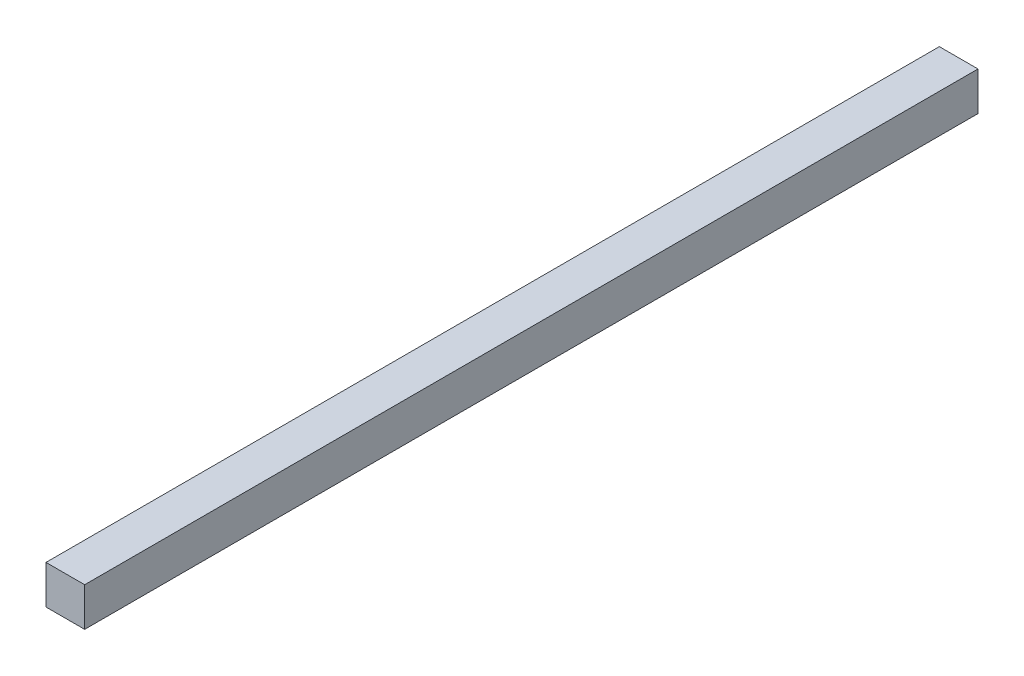
from build123d import *

# Parameters (mm, degrees)
ESQUISSE1_W        = 10
ESQUISSE1_H        = 10
BOSS_EXTRU_1_DEPTH = 231


with BuildPart() as part:
    # Esquisse1 → Boss.-Extru.1 (new body)
    with BuildSketch(Plane.XY):
        with Locations((5, 5)):
            Rectangle(ESQUISSE1_W, ESQUISSE1_H)
    extrude(amount=BOSS_EXTRU_1_DEPTH)


solid = part.part
